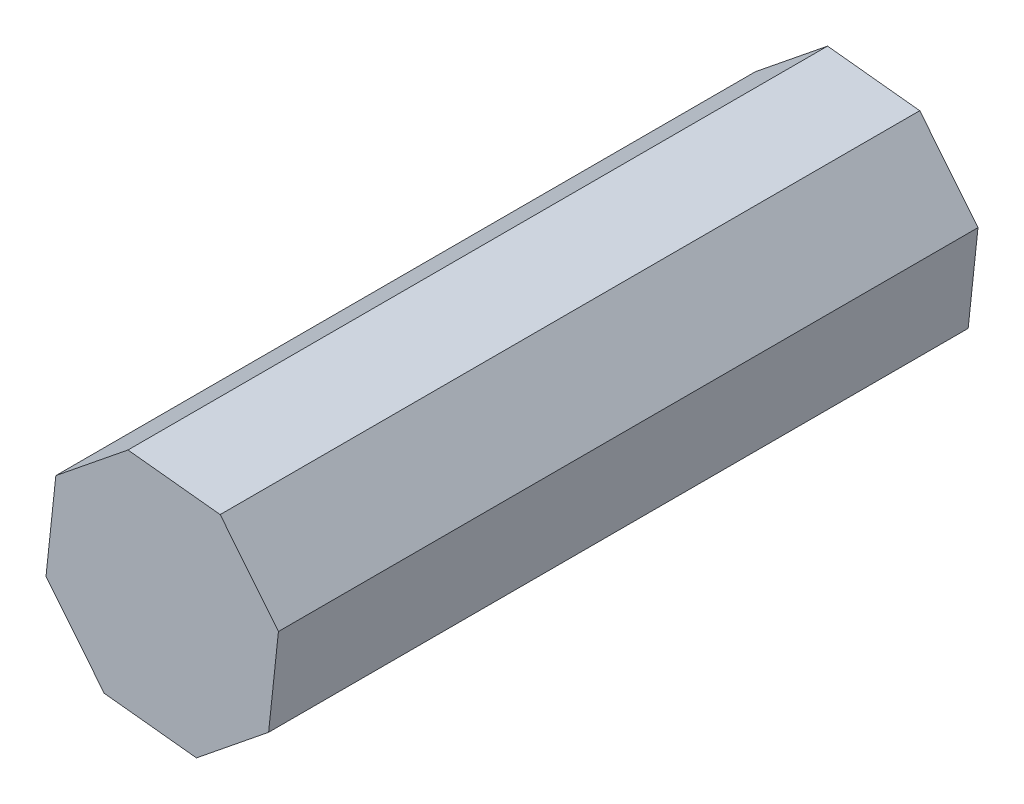
from build123d import *

# Parameters (mm, degrees)
RESSALTO_EXTRUS_O1_DEPTH = 100
CORTE_EXTRUS_O1_DEPTH    = 20


with BuildPart() as part:
    # Esboço2 → Ressalto-extrusão1 (new body)
    with BuildSketch(Plane.XY):
        Polygon((15.207285045, -8.286201641), (16.612403749, 4.893945008), (8.286201641, 15.207285045), (-4.893945008, 16.612403749), (-15.207285045, 8.286201641), (-16.612403749, -4.893945008), (-8.286201641, -15.207285045), (4.893945008, -16.612403749), align=None)
    extrude(amount=RESSALTO_EXTRUS_O1_DEPTH)

    # Esboço1 → Corte-extrusão1 (cut)
    with BuildSketch(Plane.XY):
        Polygon((10.930236126, -5.95570743), (11.940165195, 3.517522974), (5.95570743, 10.930236126), (-3.517522974, 11.940165195), (-10.930236126, 5.95570743), (-11.940165195, -3.517522974), (-5.95570743, -10.930236126), (3.517522974, -11.940165195), align=None)
    extrude(amount=CORTE_EXTRUS_O1_DEPTH, mode=Mode.SUBTRACT)


solid = part.part
